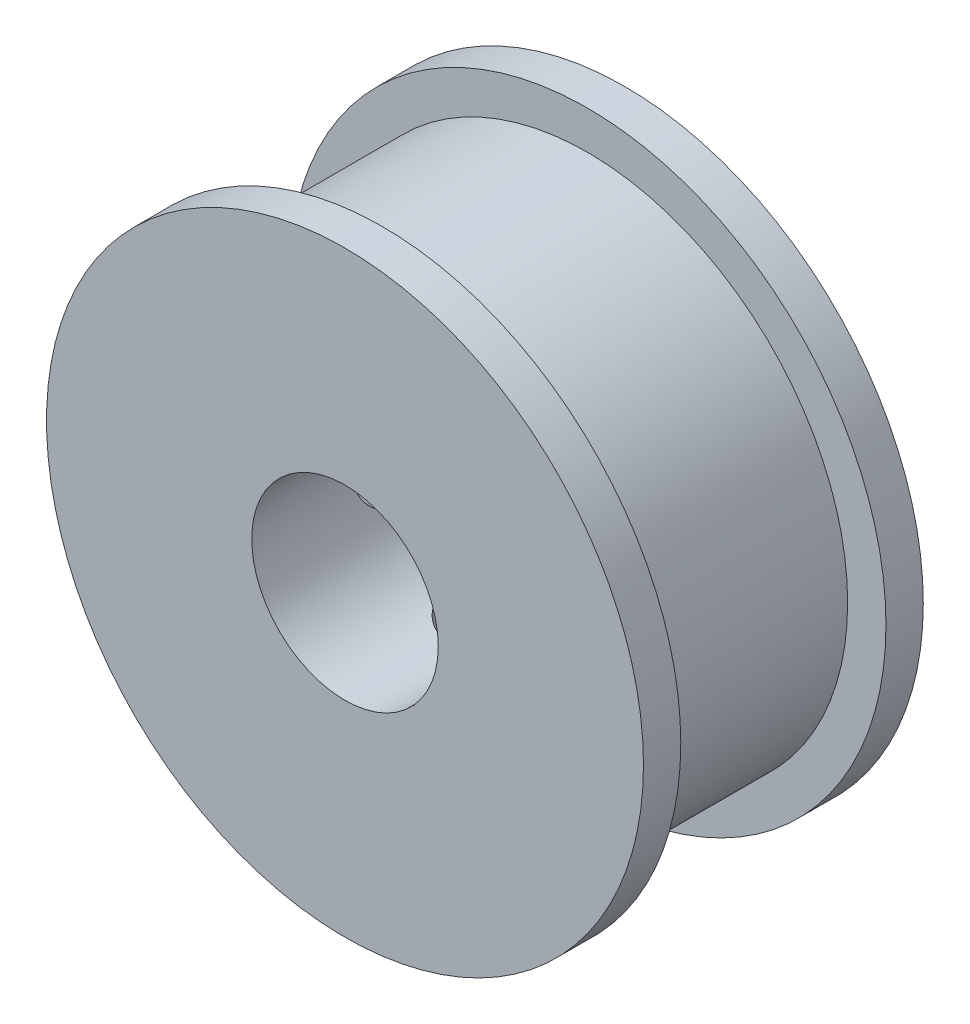
from build123d import *

# Parameters (mm, degrees)
SKETCH_1_R          = 16
EXTRUDE_1_DEPTH     = 2
SKETCH_2_R          = 13.945
EXTRUDE_2_DEPTH     = 11
SKETCH_3_R          = 16
EXTRUDE_3_DEPTH     = 2
SKETCH_4_R          = 5
CUT_EXTRUDE_1_DEPTH = 15
SKETCH_5_R          = 2
CUT_EXTRUDE_2_DEPTH = 20
SKETCH_8_R          = 2
CUT_EXTRUDE_3_DEPTH = 20


with BuildPart() as part:
    # 草图1 → 凸台-拉伸1 (new body)
    with BuildSketch(Plane.XY):
        Circle(SKETCH_1_R)
    extrude(amount=EXTRUDE_1_DEPTH)

    # 草图2 → 凸台-拉伸2 (add)
    with BuildSketch(Plane.XY.offset(2)):
        Circle(SKETCH_2_R)
    extrude(amount=EXTRUDE_2_DEPTH)

    # 草图3 → 凸台-拉伸3 (add)
    with BuildSketch(Plane.XY.offset(13)):
        Circle(SKETCH_3_R)
    extrude(amount=EXTRUDE_3_DEPTH)

    # 草图4 → 切除-拉伸1 (cut)
    with BuildSketch(Plane.XY.offset(15)):
        Circle(SKETCH_4_R)
    extrude(amount=-CUT_EXTRUDE_1_DEPTH, mode=Mode.SUBTRACT)

    # 草图5 → 切除-拉伸2 (cut)
    with BuildSketch(Plane(origin=(0, 0, 0), x_dir=(1, 0, 0), z_dir=(0, 1, 0))):
        with Locations(Location((0, -7.5, 0), (0, 0, 270))):
            Circle(SKETCH_5_R)
    extrude(amount=-CUT_EXTRUDE_2_DEPTH, mode=Mode.SUBTRACT)

    # 草图8 → 切除-拉伸3 (cut)
    with BuildSketch(Plane(origin=(0, 0, 0), x_dir=(0, 0, -1), z_dir=(1, 0, 0))):
        with Locations((-7.5, 0)):
            Circle(SKETCH_8_R)
    extrude(amount=-CUT_EXTRUDE_3_DEPTH, mode=Mode.SUBTRACT)


solid = part.part
